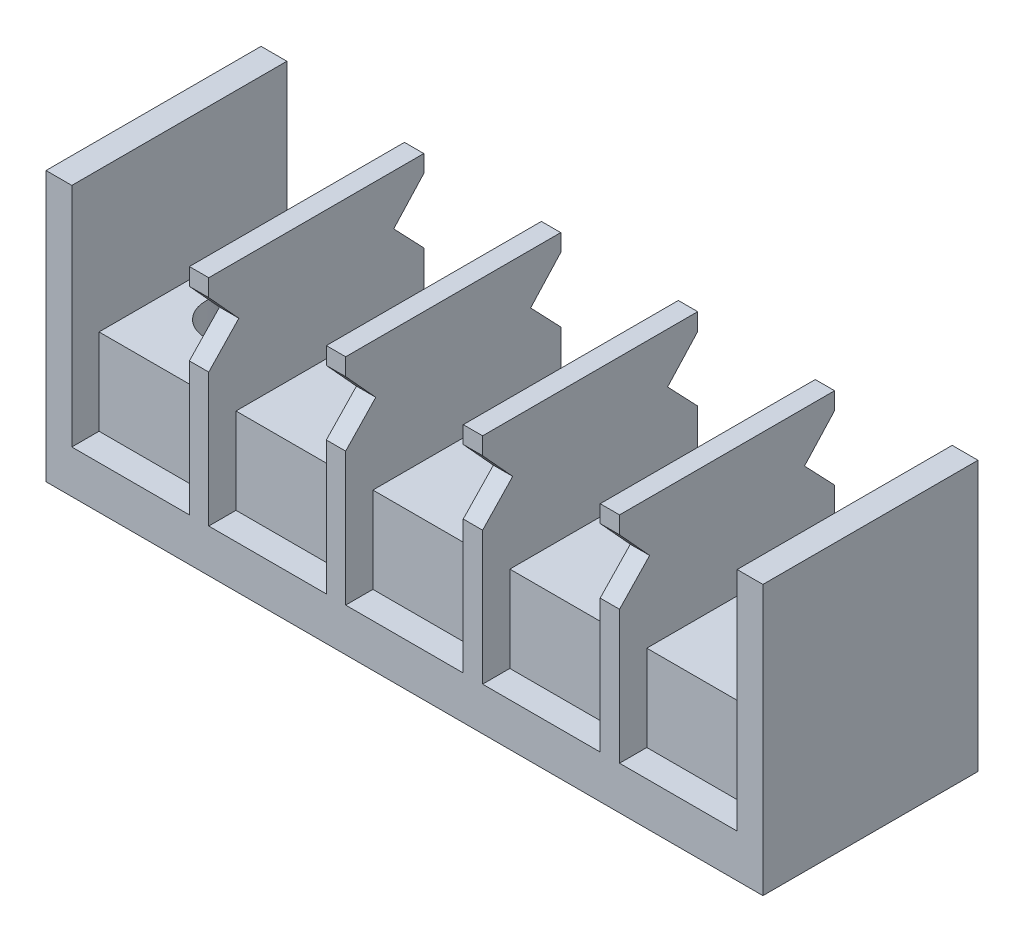
from build123d import *

# Parameters (mm, degrees)
SKETCH_1_W          = 50
SKETCH_1_H          = 15
EXTRUDE_1_DEPTH     = 18.8
SKETCH_2_W          = 46.4
SKETCH_2_H          = 15
CUT_EXTRUDE_1_DEPTH = 0.8
SKETCH_4_W          = 8.2
SKETCH_4_H          = 15
CUT_EXTRUDE_2_DEPTH = 9
SKETCH_5_W          = 8.2
SKETCH_5_H          = 1.9
CUT_EXTRUDE_3_DEPTH = 15
SKETCH_6_W          = 1.5
SKETCH_6_H          = 0.75
EXTRUDE_2_DEPTH     = 5.8
SKETCH_7_R          = 2.25
CUT_EXTRUDE_4_DEPTH = 31.004832944
CUT_EXTRUDE_START   = -30
CUT_EXTRUDE_5_DEPTH = 30


with BuildPart() as part:
    # 草图1 → 拉伸1 (new body)
    with BuildSketch(Plane(origin=(0, 0, 0), x_dir=(1, 0, 0), z_dir=(0, 1, 0))):
        Rectangle(SKETCH_1_W, SKETCH_1_H)
    extrude(amount=EXTRUDE_1_DEPTH)

    # 草图2 → 切除-拉伸1 (cut)
    with BuildSketch(Plane(origin=(0, 18.8, 0), x_dir=(-1, 0, 0), z_dir=(0, 1, 0))):
        Rectangle(SKETCH_2_W, SKETCH_2_H)
    extrude(amount=-CUT_EXTRUDE_1_DEPTH, mode=Mode.SUBTRACT)

    # 草图4 → 切除-拉伸2 (cut)
    with BuildSketch(Plane(origin=(0, 18, 0), x_dir=(-1, 0, 0), z_dir=(0, 1, 0))):
        with Locations((-19.1, 0)):
            Rectangle(SKETCH_4_W, SKETCH_4_H)
        with Locations((-9.55, 0)):
            Rectangle(SKETCH_4_W, SKETCH_4_H)
        Rectangle(SKETCH_4_W, SKETCH_4_H)
        with Locations((9.55, 0)):
            Rectangle(SKETCH_4_W, SKETCH_4_H)
        with Locations((19.1, 0)):
            Rectangle(SKETCH_4_W, SKETCH_4_H)
    extrude(amount=-CUT_EXTRUDE_2_DEPTH, mode=Mode.SUBTRACT)

    # 草图5 → 切除-拉伸3 (cut)
    with BuildSketch(Plane(origin=(0, 18, 0), x_dir=(-1, 0, 0), z_dir=(0, 1, 0))):
        with Locations((19.1, -6.55)):
            Rectangle(SKETCH_5_W, SKETCH_5_H)
        with Locations((19.1, 6.55)):
            Rectangle(SKETCH_5_W, SKETCH_5_H)
        with Locations((9.55, -6.55)):
            Rectangle(SKETCH_5_W, SKETCH_5_H)
        with Locations((9.55, 6.55)):
            Rectangle(SKETCH_5_W, SKETCH_5_H)
        with Locations((0, -6.55)):
            Rectangle(SKETCH_5_W, SKETCH_5_H)
        with Locations((0, 6.55)):
            Rectangle(SKETCH_5_W, SKETCH_5_H)
        with Locations((-9.55, -6.55)):
            Rectangle(SKETCH_5_W, SKETCH_5_H)
        with Locations((-9.55, 6.55)):
            Rectangle(SKETCH_5_W, SKETCH_5_H)
        with Locations((-19.1, -6.55)):
            Rectangle(SKETCH_5_W, SKETCH_5_H)
        with Locations((-19.1, 6.55)):
            Rectangle(SKETCH_5_W, SKETCH_5_H)
    extrude(amount=-CUT_EXTRUDE_3_DEPTH, mode=Mode.SUBTRACT)

    # 草图6 → 拉伸2 (add)
    with BuildSketch(Plane.XZ):
        Rectangle(SKETCH_6_W, SKETCH_6_H)
        with Locations((9.55, 0)):
            Rectangle(SKETCH_6_W, SKETCH_6_H)
        with Locations((-9.55, 0)):
            Rectangle(SKETCH_6_W, SKETCH_6_H)
    extrude(amount=EXTRUDE_2_DEPTH)

    # 草图7 → 切除-拉伸4 (cut, through all)
    with BuildSketch(Plane(origin=(0, 9, 0), x_dir=(-1, 0, 0), z_dir=(0, 1, 0))):
        with Locations(Location((-19.1, 0, 0), (0, 0, 90))):
            Circle(SKETCH_7_R)
        with Locations(Location((19.1, 0, 0), (0, 0, 270))):
            Circle(SKETCH_7_R)
    extrude(amount=-CUT_EXTRUDE_4_DEPTH, mode=Mode.SUBTRACT)

    # 草图8 → 切除-拉伸5 (cut)
    with BuildSketch(Plane(origin=(15, 0, 0), x_dir=(0, 0, -1), z_dir=(1, 0, 0)).offset(CUT_EXTRUDE_START)):
        Polygon((7.5, 16.8), (5.4, 14.5), (7.5, 12.3), align=None)
        Polygon((-7.5, 16.8), (-7.5, 12.3), (-5.4, 14.5), align=None)
    extrude(amount=CUT_EXTRUDE_5_DEPTH, mode=Mode.SUBTRACT)


solid = part.part
